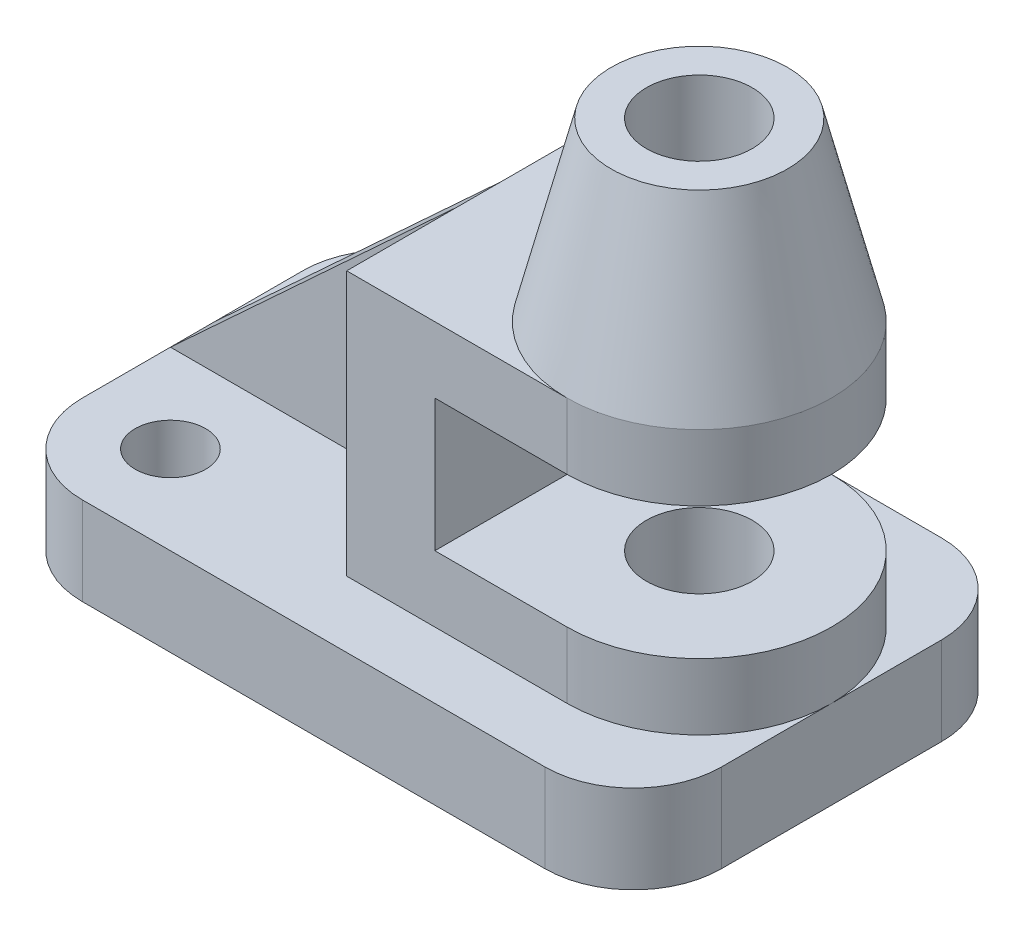
from build123d import *

# Parameters (mm, degrees)
SKETCH3_W               = 145
SKETCH3_H               = 20
BOSS_EXTRUDE3_DEPTH     = 45
BOSS_EXTRUDE6_DEPTH     = 60
CUT_EXTRUDE6_DEPTH      = 110.861912755
CUT_EXTRUDE6_DEPTH_BACK = 10
SKETCH10_W              = 60
SKETCH10_H              = 30
CUT_EXTRUDE7_DEPTH      = 90
CUT_EXTRUDE9_DEPTH      = 84
CUT_EXTRUDE9_DEPTH_BACK = 59
SKETCH11_R              = 12
SKETCH15_R              = 12
CUT_EXTRUDE10_DEPTH     = 40
SKETCH16_R              = 8
CUT_EXTRUDE11_DEPTH     = 40
FILLET1_R               = 20
FILLET2_R               = 20
FILLET3_R               = 20
FILLET4_R               = 20


with BuildPart() as part:
    # Sketch3 → Boss-Extrude3 (new, symmetric)
    with BuildSketch(Plane.XY):
        with Locations((12.618187605, -21.786578497)):
            Rectangle(SKETCH3_W, SKETCH3_H)
    extrude(amount=BOSS_EXTRUDE3_DEPTH, both=True)

    # Sketch4 → Boss-Extrude6 (add)
    with BuildSketch(Plane(origin=(0, -11.786578497, 0), x_dir=(1, 0, 0), z_dir=(0, 1, 0))):
        Polygon((5.118187605, 5), (-59.881812395, 5), (-59.881812395, -5), (5.118187605, -5), (5.118187605, 0), align=None)
        with BuildLine():
            Line((5.118187605, -30), (55.118187605, -30))
            ThreePointArc((55.118187605, -30), (85.118187605, 0), (55.118187605, 30))
            Line((55.118187605, 30), (5.118187605, 30))
            Line((5.118187605, 30), (5.118187605, 0))
            Line((5.118187605, 0), (5.118187605, -30))
        make_face()
    extrude(amount=BOSS_EXTRUDE6_DEPTH)

    # Sketch7 → Cut-Extrude6 (cut, two sides: drawn at the far end of the back side and taken through both)
    with BuildSketch(Plane.XY.offset(5).offset(-CUT_EXTRUDE6_DEPTH_BACK)):
        Polygon((-297.845774457, -231.445620401), (-59.881812395, -11.786578497), (5.118187605, 48.213421503), (243.082149668, 267.872463407), (-196.23593414, 743.800387532), (-737.163858265, 244.482303724), align=None)
    extrude(amount=CUT_EXTRUDE6_DEPTH + CUT_EXTRUDE6_DEPTH_BACK, mode=Mode.SUBTRACT)

    # Sketch10 → Cut-Extrude7 (cut)
    with BuildSketch(Plane.XY.offset(30)):
        with Locations((55.118187605, 18.213421503)):
            Rectangle(SKETCH10_W, SKETCH10_H)
    extrude(amount=-CUT_EXTRUDE7_DEPTH, mode=Mode.SUBTRACT)

    # Sketch11 → Cut-Extrude9 (cut, two sides: drawn at the far end of the back side and taken through both)
    with BuildSketch(Plane(origin=(0, 3.213421503, 0), x_dir=(1, 0, 0), z_dir=(0, 1, 0)).offset(-CUT_EXTRUDE9_DEPTH_BACK)):
        with Locations(Location((55.118187605, 0, 0), (0, 0, 90))):
            Circle(SKETCH11_R)
    extrude(amount=CUT_EXTRUDE9_DEPTH + CUT_EXTRUDE9_DEPTH_BACK, mode=Mode.SUBTRACT)

    # Sketch13 → Revolve1 (revolve)
    with BuildSketch(Plane.XY, mode=Mode.PRIVATE) as revolve1_sk:
        Polygon((55.118187605, 48.213421503), (55.118187605, 88.213421503), (35.118187605, 88.213421503), (25.118187605, 48.213421503), align=None)
    revolve(revolve1_sk.sketch.rotate(Axis((55.118187605, 48.213421503, 0), (0, 1, 0)), 90), axis=Axis((55.118187605, 48.213421503, 0), (0, 1, 0)))

    # Sketch15 → Cut-Extrude10 (cut)
    with BuildSketch(Plane(origin=(0, 88.213421503, 0), x_dir=(1, 0, 0), z_dir=(0, 1, 0))):
        with Locations(Location((55.118187605, 0, 0), (0, 0, 90))):
            Circle(SKETCH15_R)
    extrude(amount=-CUT_EXTRUDE10_DEPTH, mode=Mode.SUBTRACT)

    # Sketch16 → Cut-Extrude11 (cut)
    with BuildSketch(Plane(origin=(0, -11.786578497, 0), x_dir=(1, 0, 0), z_dir=(0, 1, 0))):
        with Locations(Location((-39.881812395, -25, 0), (0, 0, 270))):
            Circle(SKETCH16_R)
        with Locations(Location((-39.881812395, 25, 0), (0, 0, 270))):
            Circle(SKETCH16_R)
    extrude(amount=-CUT_EXTRUDE11_DEPTH, mode=Mode.SUBTRACT)

    # Fillet1
    fillet1_edges = [part.edges().sort_by_distance(p)[0] for p in [
        (-59.881812395, -21.786578497, 45),
    ]]
    fillet(fillet1_edges, radius=FILLET1_R)

    # Fillet2
    fillet2_edges = [part.edges().sort_by_distance(p)[0] for p in [
        (-59.881812395, -21.786578497, -45),
    ]]
    fillet(fillet2_edges, radius=FILLET2_R)

    # Fillet3
    fillet3_edges = [part.edges().sort_by_distance(p)[0] for p in [
        (85.118187605, -21.786578497, -45),
    ]]
    fillet(fillet3_edges, radius=FILLET3_R)

    # Fillet4
    fillet4_edges = [part.edges().sort_by_distance(p)[0] for p in [
        (85.118187605, -21.786578497, 45),
    ]]
    fillet(fillet4_edges, radius=FILLET4_R)


solid = part.part
